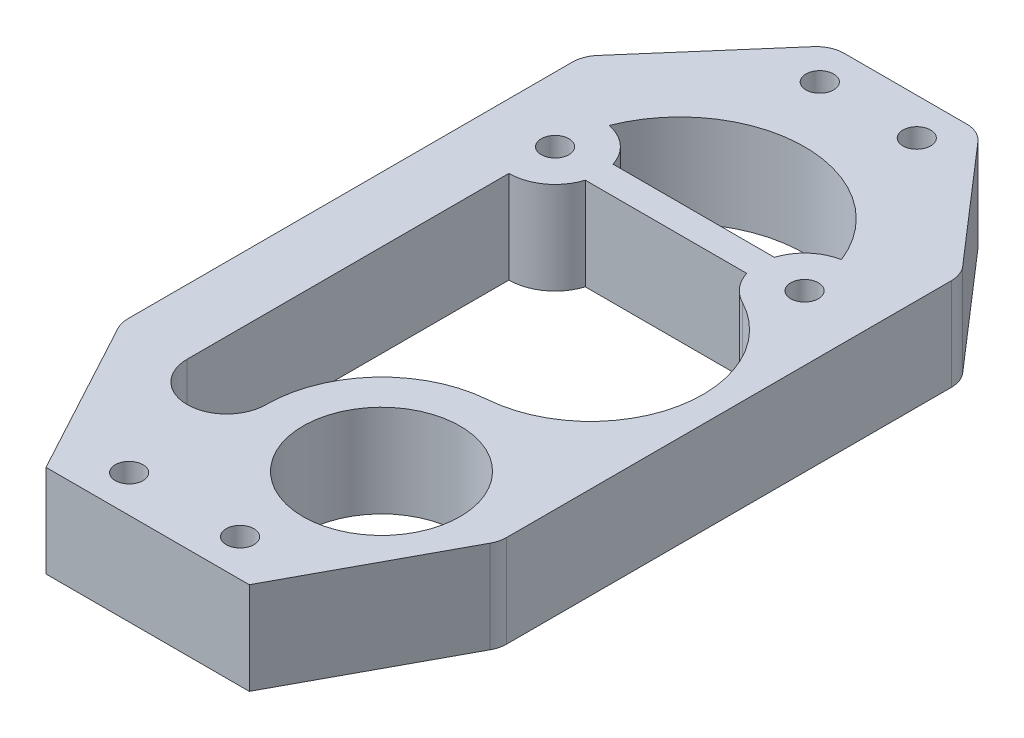
from build123d import *

# Parameters (mm, degrees)
SKETCH1_R           = 1.5
SKETCH1_R_2         = 8.5
BOSS_EXTRUDE1_DEPTH = 5
FILLET1_R           = 3


with BuildPart() as part:
    # Sketch1 → Boss-Extrude1 (new, symmetric)
    with BuildSketch(Plane(origin=(0, 0, 0), x_dir=(1, 0, 0), z_dir=(0, 1, 0))):
        Polygon((8, 24.400284093), (-8, 24.400284093), (-20.5, 10), (-20.5, -40), (-11, -57.599715907), (11, -57.599715907), (20.5, -40), (20.5, 10), align=None)
        with Locations(Location((-5.25, 20.39454584, 0), (0, 0, 270))):
            Circle(SKETCH1_R, mode=Mode.SUBTRACT)
        with Locations(Location((-6, -53.599715907, 0), (0, 0, 270))):
            Circle(SKETCH1_R, mode=Mode.SUBTRACT)
        with Locations(Location((6, -53.599715907, 0), (0, 0, 90))):
            Circle(SKETCH1_R, mode=Mode.SUBTRACT)
        with Locations(Location((5.25, 20.39454584, 0), (0, 0, 90))):
            Circle(SKETCH1_R, mode=Mode.SUBTRACT)
        with Locations(Location((-13.5, 0, 0), (0, 0, 270))):
            Circle(SKETCH1_R, mode=Mode.SUBTRACT)
        with Locations(Location((13.5, 0, 0), (0, 0, 270))):
            Circle(SKETCH1_R, mode=Mode.SUBTRACT)
        with Locations(Location((7.530163354, -39.817414772, 0), (0, 0, 270))):
            Circle(SKETCH1_R_2, mode=Mode.SUBTRACT)
        with BuildLine():
            Line((-13.5, -5), (-13.5, -39.817414772))
            ThreePointArc((-13.5, -39.817414772), (-9.234918323, -44.082496449), (-4.969836646, -39.817414772))
            ThreePointArc((-4.969836646, -39.817414772), (-1.654816501, -31.338845018), (6.531946565, -27.35733599))
            ThreePointArc((6.531946565, -27.35733599), (17.487572325, -17.647670786), (11.187975781, -4.433344563))
            ThreePointArc((11.187975781, -4.433344563), (9.667400631, -3.211102938), (8.730303993, -1.5))
            Line((8.730303993, -1.5), (-8.730303993, -1.5))
            ThreePointArc((-8.730303993, -1.5), (-10.541960108, -4.031128874), (-13.5, -5))
        make_face(mode=Mode.SUBTRACT)
        with BuildLine():
            Line((8.730303993, 1.5), (-8.730303993, 1.5))
            ThreePointArc((-8.730303993, 1.5), (-10.179901517, 3.738575405), (-12.574074074, 4.913518208))
            ThreePointArc((-12.574074074, 4.913518208), (0, 13.5), (12.574074074, 4.913518208))
            ThreePointArc((12.574074074, 4.913518208), (10.179901517, 3.738575405), (8.730303993, 1.5))
        make_face(mode=Mode.SUBTRACT)
    extrude(amount=BOSS_EXTRUDE1_DEPTH, both=True)

    # Fillet1
    fillet1_edges = [part.edges().sort_by_distance(p)[0] for p in [
        (-20.5, 0, 40),
        (-20.5, 0, -10),
        (-8, 0, -24.400284093),
        (8, 0, -24.400284093),
        (20.5, 0, -10),
        (20.5, 0, 40),
    ]]
    fillet(fillet1_edges, radius=FILLET1_R)


solid = part.part
